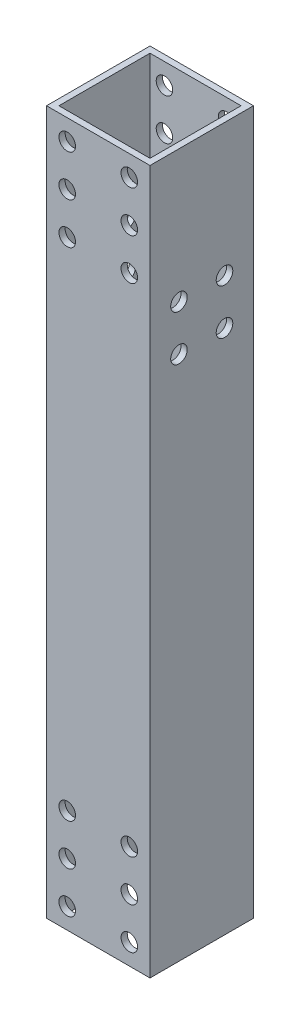
from build123d import *

# Parameters (mm, degrees)
BOSS_EXTRUDE1_DEPTH      = 85
BOSS_EXTRUDE1_DEPTH_BACK = 85
SKETCH1_W                = 25
SKETCH1_H                = 25
SKETCH1_W_2              = 22
SKETCH1_H_2              = 22
SKETCH2_R                = 2
CUT_EXTRUDE1_DEPTH       = 25
SKETCH3_R                = 2
CUT_EXTRUDE2_DEPTH       = 25


with BuildPart() as part:
    # Sketch1 → Boss-Extrude1 (new, two sides: drawn at the far end of the back side and taken through both)
    with BuildSketch(Plane(origin=(0, 0, 0), x_dir=(1, 0, 0), z_dir=(0, 1, 0)).offset(-BOSS_EXTRUDE1_DEPTH_BACK)):
        Rectangle(SKETCH1_W, SKETCH1_H)
        Rectangle(SKETCH1_W_2, SKETCH1_H_2, mode=Mode.SUBTRACT)
    extrude(amount=BOSS_EXTRUDE1_DEPTH + BOSS_EXTRUDE1_DEPTH_BACK)

    # Sketch2 → Cut-Extrude1 (cut)
    with BuildSketch(Plane(origin=(0, 0, -12.5), x_dir=(-1, 0, 0), z_dir=(0, 0, -1))):
        with Locations((7.5, 80)):
            Circle(SKETCH2_R)
        with Locations((7.5, 70)):
            Circle(SKETCH2_R)
        with Locations((-7.5, 80)):
            Circle(SKETCH2_R)
        with Locations((-7.5, 70)):
            Circle(SKETCH2_R)
        with Locations((7.5, 60)):
            Circle(SKETCH2_R)
        with Locations((-7.5, 60)):
            Circle(SKETCH2_R)
    cut_extrude1 = extrude(amount=-CUT_EXTRUDE1_DEPTH, mode=Mode.SUBTRACT)

    # Mirror1: Cut-Extrude1 across plane
    add(cut_extrude1.mirror(Plane.ZX), mode=Mode.SUBTRACT)

    # Sketch3 → Cut-Extrude2 (cut)
    with BuildSketch(Plane(origin=(12.5, 0, 0), x_dir=(0, 0, -1), z_dir=(1, 0, 0))):
        with Locations((5.5, 53)):
            Circle(SKETCH3_R)
        with Locations((5.5, 42)):
            Circle(SKETCH3_R)
        with Locations((-5.5, 53)):
            Circle(SKETCH3_R)
        with Locations((-5.5, 42)):
            Circle(SKETCH3_R)
    extrude(amount=-CUT_EXTRUDE2_DEPTH, mode=Mode.SUBTRACT)


solid = part.part
